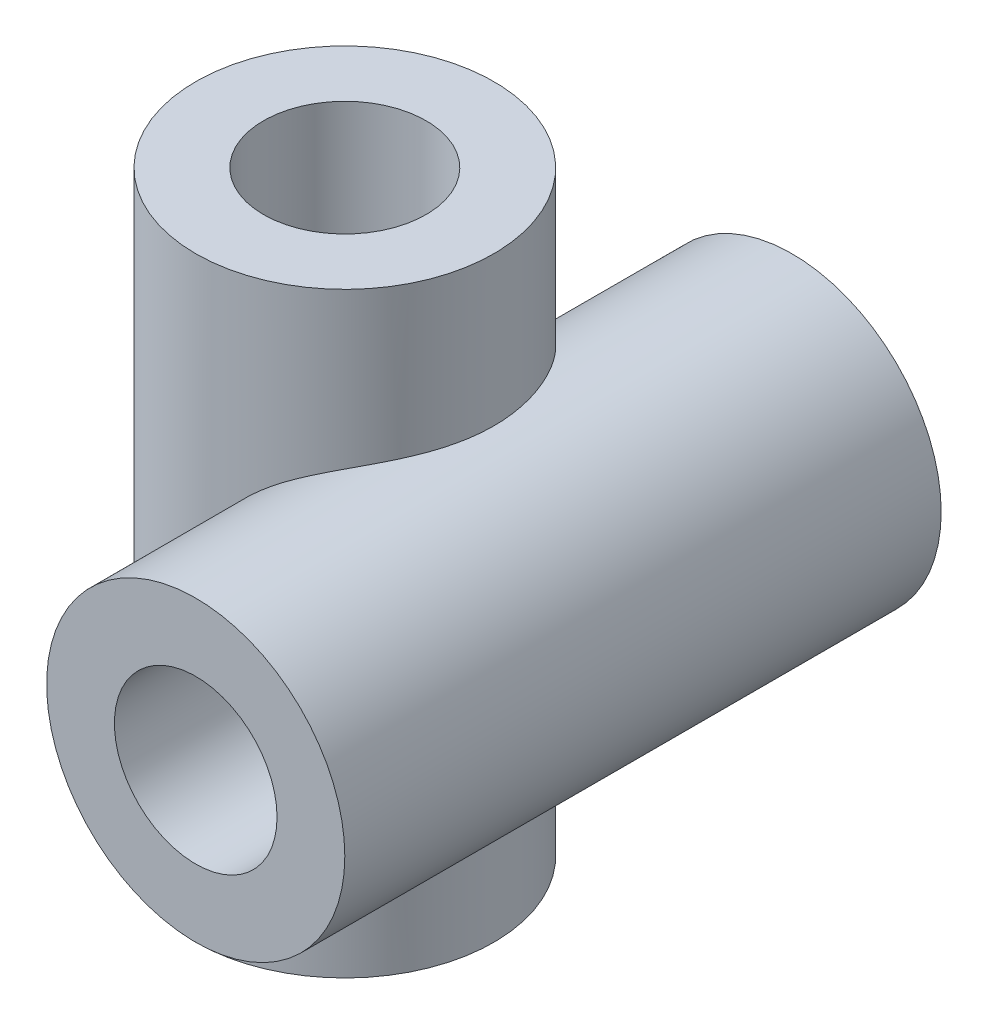
from build123d import *

# Parameters (mm, degrees)
SKETCH1_R           = 27.5
BOSS_EXTRUDE2_DEPTH = 110
SKETCH2_R           = 27.5
BOSS_EXTRUDE3_DEPTH = 55
SKETCH3_R           = 15
CUT_EXTRUDE1_DEPTH  = 110
SKETCH5_R           = 15
CUT_EXTRUDE2_DEPTH  = 110


with BuildPart() as part:
    # Sketch1 → Boss-Extrude2 (new body)
    with BuildSketch(Plane(origin=(0, 0, 0), x_dir=(1, 0, 0), z_dir=(0, 1, 0))):
        with Locations(Location((0, 0, 0), (0, 0, 270))):
            Circle(SKETCH1_R)
    extrude(amount=BOSS_EXTRUDE2_DEPTH)

    # Sketch2 → Boss-Extrude3 (add, symmetric)
    with BuildSketch(Plane.XY):
        with Locations((27.5, 55)):
            Circle(SKETCH2_R)
    extrude(amount=BOSS_EXTRUDE3_DEPTH, both=True)

    # Sketch3 → Cut-Extrude1 (cut)
    with BuildSketch(Plane(origin=(0, 110, 0), x_dir=(1, 0, 0), z_dir=(0, 1, 0))):
        with Locations(Location((0, 0, 0), (0, 0, 270))):
            Circle(SKETCH3_R)
    extrude(amount=-CUT_EXTRUDE1_DEPTH, mode=Mode.SUBTRACT)

    # Sketch5 → Cut-Extrude2 (cut)
    with BuildSketch(Plane.XY.offset(55)):
        with Locations((27.5, 55)):
            Circle(SKETCH5_R)
    extrude(amount=-CUT_EXTRUDE2_DEPTH, mode=Mode.SUBTRACT)


solid = part.part
